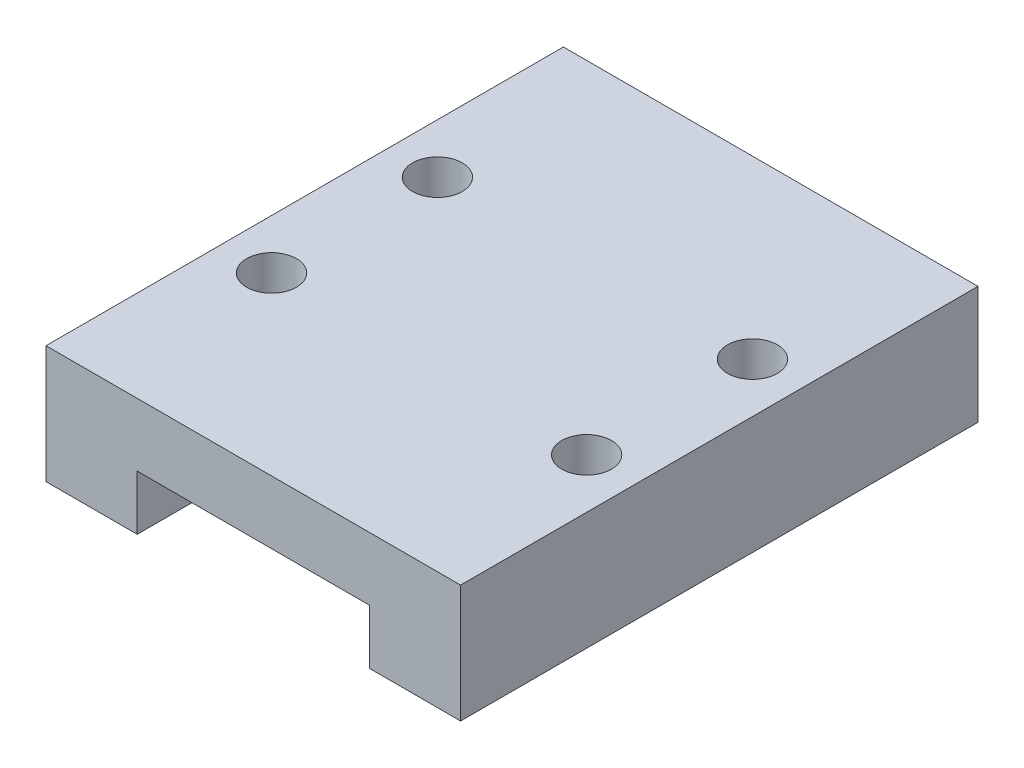
from build123d import *

# Parameters (mm, degrees)
SKETCH_1_W               = 25
SKETCH_1_H               = 7.1
EXTRUDE_1_DEPTH          = 15.6
CUT_EXTRUDE_1_DEPTH      = 34.797817977
CUT_EXTRUDE_1_DEPTH_BACK = 34.797817977
SKETCH_2_W               = 14
SKETCH_2_H               = 3.3
SKETCH_3_R               = 1.5
CUT_EXTRUDE_2_DEPTH      = 3


with BuildPart() as part:
    # 草图1 → 凸台-拉伸1 (new, symmetric)
    with BuildSketch(Plane.XY):
        Rectangle(SKETCH_1_W, SKETCH_1_H)
    extrude(amount=EXTRUDE_1_DEPTH, both=True)

    # 草图2 → 切除-拉伸1 (cut, two sides: drawn at the far end of the back side and taken through both)
    with BuildSketch(Plane.XY.offset(15.6).offset(-CUT_EXTRUDE_1_DEPTH_BACK)):
        with Locations((0, -1.9)):
            Rectangle(SKETCH_2_W, SKETCH_2_H)
    extrude(amount=CUT_EXTRUDE_1_DEPTH + CUT_EXTRUDE_1_DEPTH_BACK, mode=Mode.SUBTRACT)

    # 草图3 → 切除-拉伸2 (cut)
    with BuildSketch(Plane(origin=(0, 3.55, 0), x_dir=(1, 0, 0), z_dir=(0, 1, 0))):
        with Locations(Location((9.5, -5, 0), (0, 0, 270))):
            Circle(SKETCH_3_R)
        with Locations(Location((-9.5, -5, 0), (0, 0, 270))):
            Circle(SKETCH_3_R)
        with Locations(Location((-9.5, 5, 0), (0, 0, 270))):
            Circle(SKETCH_3_R)
        with Locations(Location((9.5, 5, 0), (0, 0, 270))):
            Circle(SKETCH_3_R)
    extrude(amount=-CUT_EXTRUDE_2_DEPTH, mode=Mode.SUBTRACT)


solid = part.part
